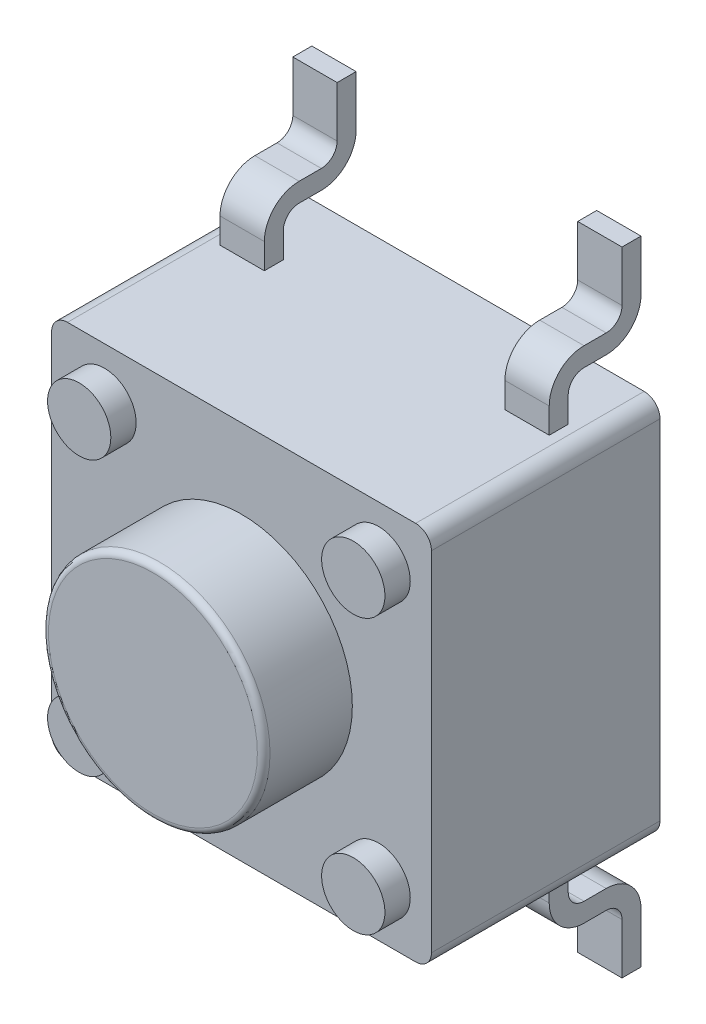
from build123d import *

# Parameters (mm, degrees)
SKETCH1_W            = 6
SKETCH1_H            = 6
BOSS_EXTRUDE1_DEPTH  = 3.61
SKETCH2_W            = 0.7
SKETCH2_H            = 0.3
BOSS_EXTRUDE2_DEPTH  = 2
SKETCH3_W            = 0.7
SKETCH3_H            = 1.35
BOSS_EXTRUDE3_DEPTH  = 1.15
SKETCH4_W            = 0.7
SKETCH4_H            = 0.3
BOSS_EXTRUDE4_DEPTH  = 2
SKETCH5_W            = 0.7
SKETCH5_H            = 1.35
BOSS_EXTRUDE5_DEPTH  = 1.15
SKETCH6_W            = 0.7
SKETCH6_H            = 0.3
BOSS_EXTRUDE6_DEPTH  = 2
SKETCH7_W            = 0.7
SKETCH7_H            = 1.35
BOSS_EXTRUDE7_DEPTH  = 1.15
SKETCH8_W            = 0.7
SKETCH8_H            = 0.3
BOSS_EXTRUDE8_DEPTH  = 2
SKETCH9_W            = 0.7
SKETCH9_H            = 1.35
BOSS_EXTRUDE9_DEPTH  = 1.15
CUT_EXTRUDE1_REACH   = 10.374
SKETCH10_W           = 1.15
SKETCH10_H           = 1.05
SKETCH11_W           = 1.15
SKETCH11_H           = 1.05
CUT_EXTRUDE2_DEPTH   = 8.923010791
CUT_EXTRUDE3_REACH   = 10.374
SKETCH12_W           = 1.15
SKETCH12_H           = 1.05
SKETCH13_W           = 1.15
SKETCH13_H           = 1.05
CUT_EXTRUDE4_DEPTH   = 8.923010791
SKETCH14_W           = 0.5
SKETCH14_H           = 0.4
SKETCH15_W           = 0.5
SKETCH15_H           = 0.4
SKETCH16_W           = 0.5
SKETCH16_H           = 0.4
SKETCH17_W           = 0.5
SKETCH17_H           = 0.4
FILLET1_R            = 0.25
FILLET2_R            = 0.55
SKETCH19_R           = 1.75
BOSS_EXTRUDE10_DEPTH = 1.4
FILLET4_R            = 0.1


with BuildPart() as part:
    # Sketch1 → Boss-Extrude1 (new body)
    with BuildSketch(Plane.XY):
        Rectangle(SKETCH1_W, SKETCH1_H)
    extrude(amount=-BOSS_EXTRUDE1_DEPTH)

    # Sketch2 → Boss-Extrude2 (add)
    with BuildSketch(Plane.XZ.offset(3)):
        with Locations((-2.25, -2.41)):
            Rectangle(SKETCH2_W, SKETCH2_H)
    extrude(amount=BOSS_EXTRUDE2_DEPTH)

    # Sketch3 → Boss-Extrude3 (add)
    with BuildSketch(Plane(origin=(0, 0, -2.56), x_dir=(-1, 0, 0), z_dir=(0, 0, -1))):
        with Locations((2.25, -4.325)):
            Rectangle(SKETCH3_W, SKETCH3_H)
    extrude(amount=BOSS_EXTRUDE3_DEPTH)

    # Sketch4 → Boss-Extrude4 (add)
    with BuildSketch(Plane.XZ.offset(3)):
        with Locations((2.25, -2.41)):
            Rectangle(SKETCH4_W, SKETCH4_H)
    extrude(amount=BOSS_EXTRUDE4_DEPTH)

    # Sketch5 → Boss-Extrude5 (add)
    with BuildSketch(Plane(origin=(0, 0, -2.56), x_dir=(-1, 0, 0), z_dir=(0, 0, -1))):
        with Locations((-2.25, -4.325)):
            Rectangle(SKETCH5_W, SKETCH5_H)
    extrude(amount=BOSS_EXTRUDE5_DEPTH)

    # Sketch6 → Boss-Extrude6 (add)
    with BuildSketch(Plane(origin=(0, 3, 0), x_dir=(-1, 0, 0), z_dir=(0, 1, 0))):
        with Locations((2.25, -2.41)):
            Rectangle(SKETCH6_W, SKETCH6_H)
    extrude(amount=BOSS_EXTRUDE6_DEPTH)

    # Sketch7 → Boss-Extrude7 (add)
    with BuildSketch(Plane(origin=(0, 0, -2.56), x_dir=(-1, 0, 0), z_dir=(0, 0, -1))):
        with Locations((2.25, 4.325)):
            Rectangle(SKETCH7_W, SKETCH7_H)
    extrude(amount=BOSS_EXTRUDE7_DEPTH)

    # Sketch8 → Boss-Extrude8 (add)
    with BuildSketch(Plane(origin=(0, 3, 0), x_dir=(-1, 0, 0), z_dir=(0, 1, 0))):
        with Locations((-2.25, -2.41)):
            Rectangle(SKETCH8_W, SKETCH8_H)
    extrude(amount=BOSS_EXTRUDE8_DEPTH)

    # Sketch9 → Boss-Extrude9 (add)
    with BuildSketch(Plane(origin=(0, 0, -2.56), x_dir=(-1, 0, 0), z_dir=(0, 0, -1))):
        with Locations((-2.25, 4.325)):
            Rectangle(SKETCH9_W, SKETCH9_H)
    extrude(amount=BOSS_EXTRUDE9_DEPTH)

    # Sketch10 → Cut-Extrude1 (cut, up to next)
    with BuildSketch(Plane.ZY.offset(2.6), mode=Mode.PRIVATE) as cut_extrude1_sk1:
        with Locations((-2.835, -4.475)):
            Rectangle(SKETCH10_W, SKETCH10_H)
    cut_extrude1_tool1 = extrude(cut_extrude1_sk1.sketch, amount=-CUT_EXTRUDE1_REACH, mode=Mode.PRIVATE) & part.part
    add(cut_extrude1_tool1.solids().sort_by_distance((-2.6, -4.475, -2.835))[0], mode=Mode.SUBTRACT)

    # Sketch11 → Cut-Extrude2 (cut, through all)
    with BuildSketch(Plane.ZY.offset(-1.9)):
        with Locations((-2.835, -4.475)):
            Rectangle(SKETCH11_W, SKETCH11_H)
    extrude(amount=-CUT_EXTRUDE2_DEPTH, mode=Mode.SUBTRACT)

    # Sketch12 → Cut-Extrude3 (cut, up to next)
    with BuildSketch(Plane.ZY.offset(2.6), mode=Mode.PRIVATE) as cut_extrude3_sk1:
        with Locations((-2.835, 4.475)):
            Rectangle(SKETCH12_W, SKETCH12_H)
    cut_extrude3_tool1 = extrude(cut_extrude3_sk1.sketch, amount=-CUT_EXTRUDE3_REACH, mode=Mode.PRIVATE) & part.part
    add(cut_extrude3_tool1.solids().sort_by_distance((-2.6, 4.475, -2.835))[0], mode=Mode.SUBTRACT)

    # Sketch13 → Cut-Extrude4 (cut, through all)
    with BuildSketch(Plane.ZY.offset(-1.9)):
        with Locations((-2.835, 4.475)):
            Rectangle(SKETCH13_W, SKETCH13_H)
    extrude(amount=-CUT_EXTRUDE4_DEPTH, mode=Mode.SUBTRACT)

    # Sketch14 → Revolve1 (revolve)
    with BuildSketch(Plane(origin=(0, -2.165, 0), x_dir=(-1, 0, 0), z_dir=(0, 1, 0))):
        with Locations((-2.415, 0.2)):
            Rectangle(SKETCH14_W, SKETCH14_H)
    revolve(axis=Axis((2.165, -2.165, 0), (0, 0, 1)))

    # Sketch15 → Revolve2 (revolve)
    with BuildSketch(Plane(origin=(0, -2.165, 0), x_dir=(-1, 0, 0), z_dir=(0, 1, 0))):
        with Locations((1.915, 0.2)):
            Rectangle(SKETCH15_W, SKETCH15_H)
    revolve(axis=Axis((-2.165, -2.165, 0), (0, 0, 1)))

    # Sketch16 → Revolve3 (revolve)
    with BuildSketch(Plane(origin=(0, 2.165, 0), x_dir=(-1, 0, 0), z_dir=(0, 1, 0))):
        with Locations((1.915, 0.2)):
            Rectangle(SKETCH16_W, SKETCH16_H)
    revolve(axis=Axis((-2.165, 2.165, 0), (0, 0, 1)))

    # Sketch17 → Revolve4 (revolve)
    with BuildSketch(Plane(origin=(0, 2.165, 0), x_dir=(-1, 0, 0), z_dir=(0, 1, 0))):
        with Locations((-2.415, 0.2)):
            Rectangle(SKETCH17_W, SKETCH17_H)
    revolve(axis=Axis((2.165, 2.165, 0), (0, 0, 1)))

    # Fillet1
    fillet1_edges = [part.edges().sort_by_distance(p)[0] for p in [
        (2.25, 3.65, -2.56),
        (-2.25, -3.95, -3.41),
        (2.25, -3.95, -3.41),
        (-2.25, 3.95, -3.41),
        (2.25, 3.95, -3.41),
        (-2.25, -3.65, -2.56),
        (2.25, -3.65, -2.56),
        (-3, -3, -1.805),
        (-3, 3, -1.805),
        (3, 3, -1.805),
        (3, -3, -1.805),
        (-2.25, 3.65, -2.56),
    ]]
    fillet(fillet1_edges, radius=FILLET1_R)

    # Fillet2
    fillet2_edges = [part.edges().sort_by_distance(p)[0] for p in [
        (2.25, 3.65, -3.71),
        (-2.25, -3.95, -2.26),
        (2.25, -3.95, -2.26),
        (-2.25, 3.95, -2.26),
        (2.25, 3.95, -2.26),
        (-2.25, -3.65, -3.71),
        (2.25, -3.65, -3.71),
        (-2.25, 3.65, -3.71),
    ]]
    fillet(fillet2_edges, radius=FILLET2_R)

    # Sketch19 → Boss-Extrude10 (add)
    with BuildSketch(Plane.XY):
        Circle(SKETCH19_R)
    extrude(amount=BOSS_EXTRUDE10_DEPTH)

    # Fillet4
    fillet4_edges = [part.edges().sort_by_distance(p)[0] for p in [
        (-1.75, 0, 1.4),
    ]]
    fillet(fillet4_edges, radius=FILLET4_R)


solid = part.part
